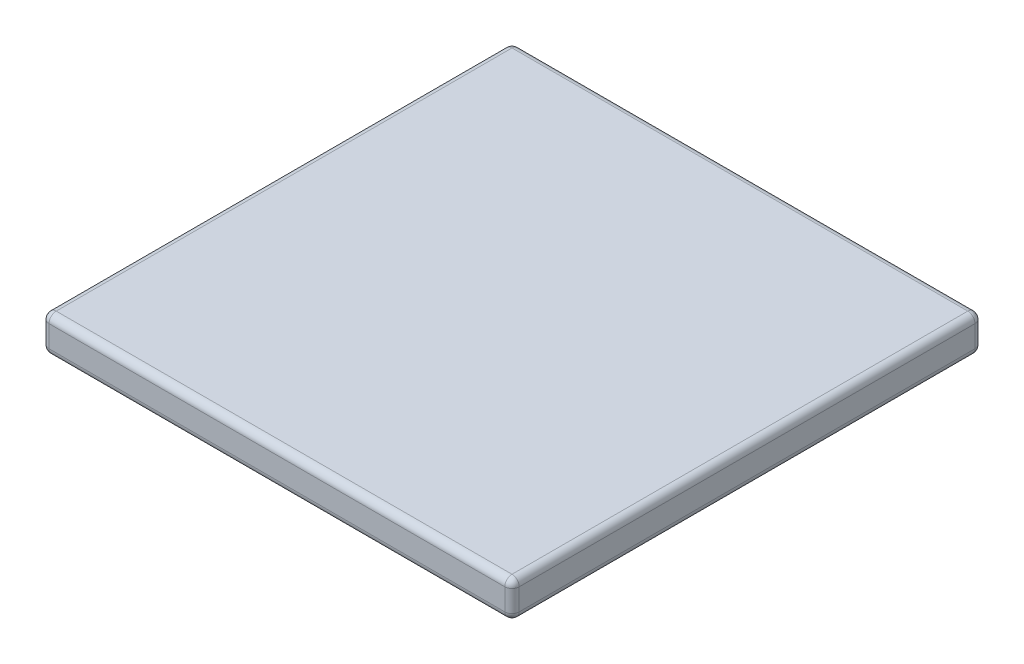
from build123d import *

# Parameters (mm, degrees)
SKETCH1_W           = 14.5
SKETCH1_H           = 14.5
BOSS_EXTRUDE1_DEPTH = 7.1
SKETCH2_W           = 11.5
SKETCH2_H           = 2
CUT_EXTRUDE1_DEPTH  = 13.471367207
SKETCH5_R           = 4.7625
BOSS_EXTRUDE2_DEPTH = 1
SKETCH6_W           = 65
SKETCH6_H           = 65
BOSS_EXTRUDE3_DEPTH = 5
FILLET1_R           = 1
FILLET2_R           = 1


with BuildPart() as part:
    # Sketch1 → Boss-Extrude1 (new body)
    with BuildSketch(Plane(origin=(0, 0, 0), x_dir=(1, 0, 0), z_dir=(0, 1, 0))):
        Rectangle(SKETCH1_W, SKETCH1_H)
    extrude(amount=BOSS_EXTRUDE1_DEPTH)

    # Sketch2 → Cut-Extrude1 (cut, through all)
    with BuildSketch(Plane(origin=(0, 7.1, 0), x_dir=(1, 0, 0), z_dir=(0, 1, 0))):
        with Locations((0, -6.25)):
            Rectangle(SKETCH2_W, SKETCH2_H)
    extrude(amount=-CUT_EXTRUDE1_DEPTH, mode=Mode.SUBTRACT)

    # Sketch5 → Boss-Extrude2 (add)
    with BuildSketch(Plane.XZ):
        with Locations(Location((0, -1, 0), (0, 0, 270))):
            Circle(SKETCH5_R)
    extrude(amount=BOSS_EXTRUDE2_DEPTH)

    # Sketch6 → Boss-Extrude3 (add)
    with BuildSketch(Plane(origin=(0, 7.1, 0), x_dir=(1, 0, 0), z_dir=(0, 1, 0))):
        Rectangle(SKETCH6_W, SKETCH6_H)
    extrude(amount=BOSS_EXTRUDE3_DEPTH)

    # Fillet1
    fillet1_edges = [part.edges().sort_by_distance(p)[0] for p in [
        (32.5, 9.6, 32.5),
        (32.5, 9.6, -32.5),
        (-32.5, 9.6, -32.5),
        (-32.5, 9.6, 32.5),
    ]]
    fillet(fillet1_edges, radius=FILLET1_R)

    # Fillet2
    fillet2_edges = [part.edges().sort_by_distance(p)[0] for p in [
        (0, 7.1, 32.5),
        (0, 12.1, 32.5),
        (32.5, 7.1, 0),
        (-32.5, 7.1, 0),
        (0, 7.1, -32.5),
        (32.207106781, 7.1, 32.207106781),
        (32.207106781, 7.1, -32.207106781),
        (-32.207106781, 7.1, -32.207106781),
        (-32.207106781, 7.1, 32.207106781),
        (-32.5, 12.1, 0),
        (32.5, 12.1, 0),
        (0, 12.1, -32.5),
        (32.207106781, 12.1, 32.207106781),
        (32.207106781, 12.1, -32.207106781),
        (-32.207106781, 12.1, -32.207106781),
        (-32.207106781, 12.1, 32.207106781),
    ]]
    fillet(fillet2_edges, radius=FILLET2_R)


solid = part.part
